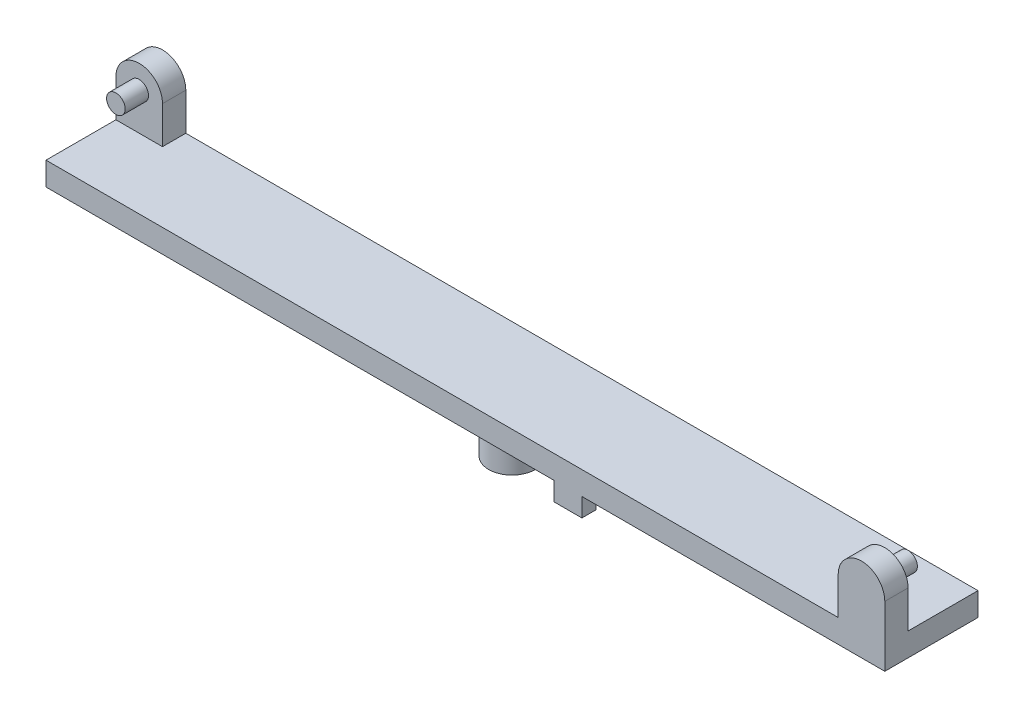
from build123d import *

# Parameters (mm, degrees)
SKETCH1_W           = 180
SKETCH1_H           = 20
SKETCH1_R           = 5
BOSS_EXTRUDE1_DEPTH = 5
BOSS_EXTRUDE4_START = -10
SKETCH2_R           = 2
BOSS_EXTRUDE4_DEPTH = 5
SKETCH2_3_R         = 2
BOSS_EXTRUDE5_DEPTH = 5
BOSS_EXTRUDE6_START = 10
SKETCH2_4_R         = 2
BOSS_EXTRUDE6_DEPTH = 5
SKETCH2_5_R         = 2
BOSS_EXTRUDE7_DEPTH = 5
SKETCH1_3_R         = 5
BOSS_EXTRUDE8_DEPTH = 10
SKETCH3_W           = 6
SKETCH3_H           = 4
BOSS_EXTRUDE9_DEPTH = 3


with BuildPart() as part:
    # Sketch1 → Boss-Extrude1 (new body)
    # profile 1 of 2: a face of its own
    with BuildSketch(Plane(origin=(0, 0, 0), x_dir=(1, 0, 0), z_dir=(0, 1, 0))):
        Rectangle(SKETCH1_W, SKETCH1_H)
        Circle(SKETCH1_R, mode=Mode.SUBTRACT)
    # profile 2 of 2: a face of its own
    with BuildSketch(Plane(origin=(0, 0, 0), x_dir=(1, 0, 0), z_dir=(0, 1, 0))):
        Circle(SKETCH1_R)
    extrude(amount=BOSS_EXTRUDE1_DEPTH)

    # Sketch2 → Boss-Extrude4 (add)
    # profile 1 of 2: a face of its own
    with BuildSketch(Plane.XY.offset(BOSS_EXTRUDE4_START)):
        with BuildLine():
            ThreePointArc((-90, 13), (-85, 18), (-80, 13))
            Line((-80, 13), (-80, 5))
            Line((-80, 5), (-90, 5))
            Line((-90, 5), (-90, 13))
        make_face()
        with Locations((-85, 13)):
            Circle(SKETCH2_R, mode=Mode.SUBTRACT)
    # profile 2 of 2: a face of its own
    with BuildSketch(Plane.XY.offset(BOSS_EXTRUDE4_START)):
        with Locations((-85, 13)):
            Circle(SKETCH2_R)
    extrude(amount=BOSS_EXTRUDE4_DEPTH)

    # Sketch2<3> → Boss-Extrude5 (add)
    with BuildSketch(Plane.XY):
        with Locations((-85, 13)):
            Circle(SKETCH2_3_R)
    extrude(amount=-BOSS_EXTRUDE5_DEPTH)

    # Sketch2<4> → Boss-Extrude6 (add)
    # profile 1 of 2: a face of its own
    with BuildSketch(Plane.XY.offset(BOSS_EXTRUDE6_START)):
        with BuildLine():
            Line((90, 5), (90, 13))
            ThreePointArc((90, 13), (85, 18), (80, 13))
            Line((80, 13), (80, 5))
            Line((80, 5), (90, 5))
        make_face()
        with Locations((85, 13)):
            Circle(SKETCH2_4_R, mode=Mode.SUBTRACT)
    # profile 2 of 2: a face of its own
    with BuildSketch(Plane.XY.offset(BOSS_EXTRUDE6_START)):
        with Locations((85, 13)):
            Circle(SKETCH2_4_R)
    extrude(amount=-BOSS_EXTRUDE6_DEPTH)

    # Sketch2<5> → Boss-Extrude7 (add)
    with BuildSketch(Plane.XY):
        with Locations((85, 13)):
            Circle(SKETCH2_5_R)
    extrude(amount=BOSS_EXTRUDE7_DEPTH)

    # Sketch1<3> → Boss-Extrude8 (add)
    with BuildSketch(Plane(origin=(0, 0, 0), x_dir=(1, 0, 0), z_dir=(0, 1, 0))):
        with Locations(Location((0, 0, 0), (0, 0, 270))):
            Circle(SKETCH1_3_R)
    extrude(amount=-BOSS_EXTRUDE8_DEPTH)

    # Sketch3 → Boss-Extrude9 (add)
    with BuildSketch(Plane.XY.offset(10)):
        with Locations((22, -2)):
            Rectangle(SKETCH3_W, SKETCH3_H)
    extrude(amount=-BOSS_EXTRUDE9_DEPTH)


solid = part.part
